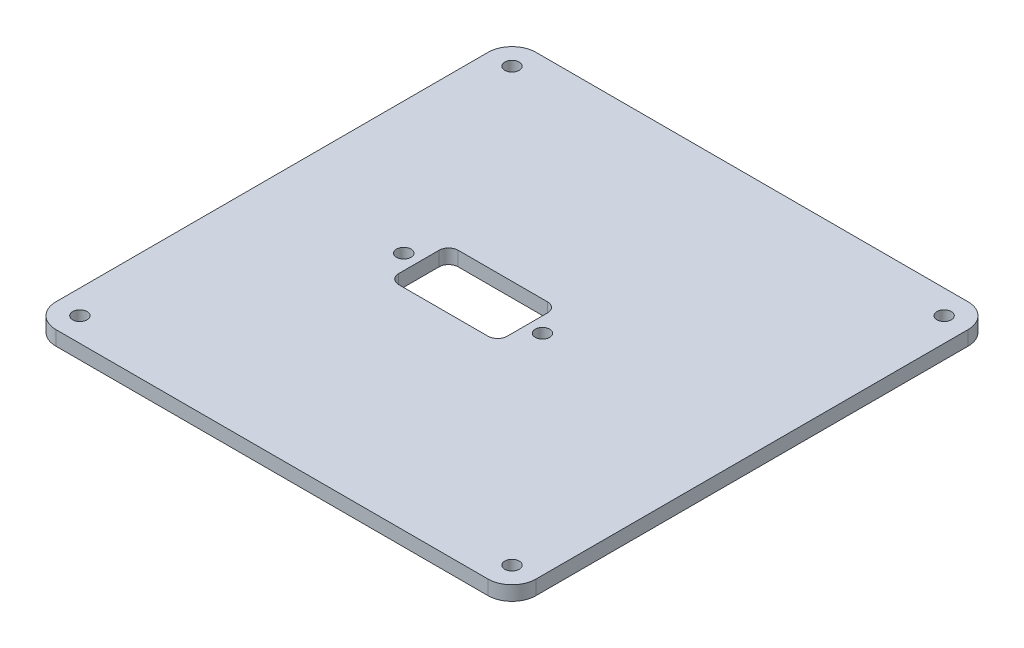
from build123d import *

# Parameters (mm, degrees)
SKETCH_1_R      = 1.5
EXTRUDE_1_DEPTH = 3


with BuildPart() as part:
    # 草图1 → 凸台-拉伸1 (new body)
    with BuildSketch(Plane(origin=(0, 0, 0), x_dir=(1, 0, 0), z_dir=(0, 1, 0))):
        with BuildLine():
            Line((-45, 50), (45, 50))
            ThreePointArc((45, 50), (48.535533906, 48.535533906), (50, 45))
            Line((50, 45), (50, -45))
            ThreePointArc((50, -45), (48.535533906, -48.535533906), (45, -50))
            Line((45, -50), (-45, -50))
            ThreePointArc((-45, -50), (-48.535533906, -48.535533906), (-50, -45))
            Line((-50, -45), (-50, 45))
            ThreePointArc((-50, 45), (-48.535533906, 48.535533906), (-45, 50))
        make_face()
        with Locations(Location((-45, 45, 0), (0, 0, 270))):
            Circle(SKETCH_1_R, mode=Mode.SUBTRACT)
        with Locations(Location((45, 45, 0), (0, 0, 270))):
            Circle(SKETCH_1_R, mode=Mode.SUBTRACT)
        with Locations(Location((-45, -45, 0), (0, 0, 270))):
            Circle(SKETCH_1_R, mode=Mode.SUBTRACT)
        with Locations(Location((45, -45, 0), (0, 0, 270))):
            Circle(SKETCH_1_R, mode=Mode.SUBTRACT)
        with Locations(Location((6.345, 0, 0), (0, 0, 270))):
            Circle(SKETCH_1_R, mode=Mode.SUBTRACT)
        with Locations(Location((-22.545, 0, 0), (0, 0, 270))):
            Circle(SKETCH_1_R, mode=Mode.SUBTRACT)
        with BuildLine():
            Line((-17.4, 6.2), (1.2, 6.2))
            ThreePointArc((1.2, 6.2), (2.614213562, 5.614213562), (3.2, 4.2))
            Line((3.2, 4.2), (3.2, -4.2))
            ThreePointArc((3.2, -4.2), (2.614213562, -5.614213562), (1.2, -6.2))
            Line((1.2, -6.2), (-17.4, -6.2))
            ThreePointArc((-17.4, -6.2), (-18.814213562, -5.614213562), (-19.4, -4.2))
            Line((-19.4, -4.2), (-19.4, 4.2))
            ThreePointArc((-19.4, 4.2), (-18.814213562, 5.614213562), (-17.4, 6.2))
        make_face(mode=Mode.SUBTRACT)
    extrude(amount=EXTRUDE_1_DEPTH)


solid = part.part
